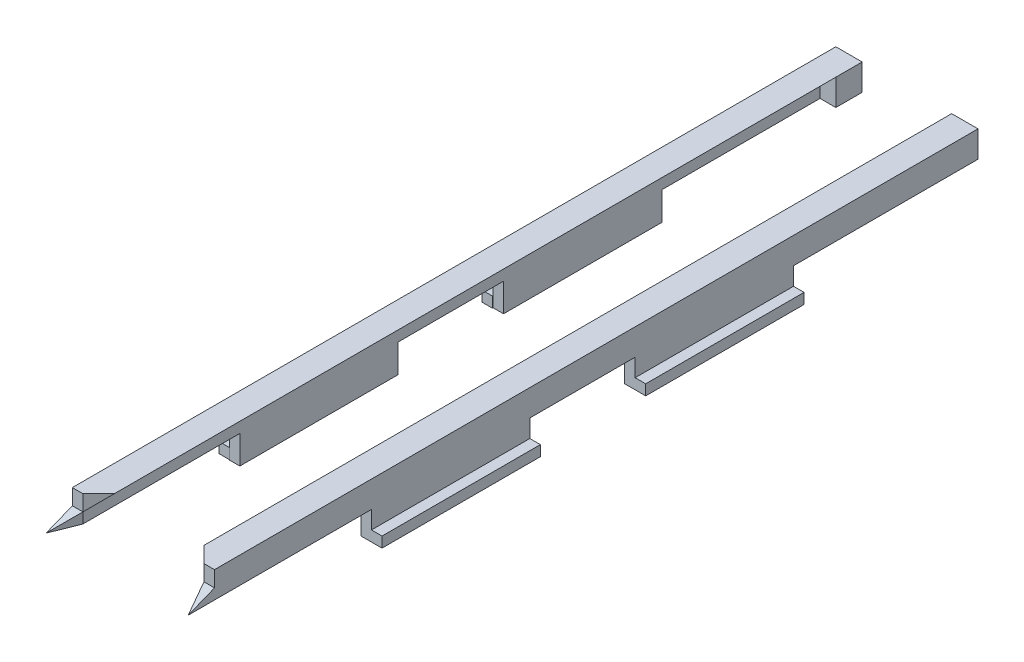
from build123d import *

# Parameters (mm, degrees)
BOSS_EXTRUDE1_DEPTH   = 145
BOSS_EXTRUDE1_2_DEPTH = 145
CUT_EXTRUDE1_DEPTH    = 3
BOSS_EXTRUDE2_DEPTH   = 2
CUT_EXTRUDE2_DEPTH    = 2
BOSS_EXTRUDE3_DEPTH   = 5
CUT_EXTRUDE3_DEPTH    = 3
BOSS_EXTRUDE4_DEPTH   = 2
CUT_EXTRUDE4_DEPTH    = 2
BOSS_EXTRUDE5_DEPTH   = 5
SKETCH12_W            = 30.080177601
SKETCH12_H            = 5.371702136
SKETCH12_W_2          = 30.0801776
BOSS_EXTRUDE6_DEPTH   = 2
SKETCH13_W            = 30.015649286
SKETCH13_H            = 2
BOSS_EXTRUDE7_DEPTH   = 2
SKETCH15_W            = 30.0801776
SKETCH15_H            = 3.371702136
SKETCH15_H_2          = 2
SKETCH15_W_2          = 30.080177601
BOSS_EXTRUDE10_DEPTH  = 2
SKETCH16_W            = 30.0801776
SKETCH16_H            = 1.992652885
SKETCH16_W_2          = 30.080177601
BOSS_EXTRUDE11_DEPTH  = 2
SKETCH17_W            = 30.214135347
SKETCH17_H            = 2
BOSS_EXTRUDE12_DEPTH  = 2


with BuildPart() as part:
    # Sketch2 → Boss-Extrude1 (new body)
    with BuildSketch(Plane.XY):
        Polygon((-11.5, 2), (-8.5, 5), (-13.5, 5), (-13.5, 0), (-11.5, 0), align=None)
    extrude(amount=BOSS_EXTRUDE1_DEPTH)

    # Sketch4 → Cut-Extrude1 (cut)
    with BuildSketch(Plane(origin=(0, 5, 0), x_dir=(1, 0, 0), z_dir=(0, 1, 0))):
        Polygon((-8.5, -145), (-8.5, -142), (-11.5, -145), align=None)
    extrude(amount=-CUT_EXTRUDE1_DEPTH, mode=Mode.SUBTRACT)

    # Sketch5 → Boss-Extrude2 (add)
    with BuildSketch(Plane(origin=(-11.5, 0, 0), x_dir=(0, 0, -1), z_dir=(1, 0, 0))):
        Polygon((-145, 0), (-150, 0), (-145, 2), align=None)
    extrude(amount=-BOSS_EXTRUDE2_DEPTH)

    # Sketch6 → Cut-Extrude2 (cut)
    with BuildSketch(Plane.XZ):
        Polygon((-13.5, 150), (-11.5, 150), (-11.5, 145), align=None)
    extrude(amount=-CUT_EXTRUDE2_DEPTH, mode=Mode.SUBTRACT)

    # Sketch7 → Boss-Extrude3 (add)
    with BuildSketch(Plane(origin=(0, 0, 0), x_dir=(-1, 0, 0), z_dir=(0, 0, -1))):
        Polygon((8.5, 5), (11.5, 2), (11.5, 0), (8.5, 0), align=None)
    extrude(amount=-BOSS_EXTRUDE3_DEPTH)

    # Sketch12 → Boss-Extrude6 (add)
    with BuildSketch(Plane(origin=(-13.5, 0, 0), x_dir=(0, 0, -1), z_dir=(1, 0, 0))):
        with Locations((-50.069244291, -2.685851068)):
            Rectangle(SKETCH12_W, SKETCH12_H)
        with Locations((-100.149421892, -2.685851068)):
            Rectangle(SKETCH12_W_2, SKETCH12_H)
    extrude(amount=BOSS_EXTRUDE6_DEPTH)

    # Sketch13 → Boss-Extrude7 (add)
    with BuildSketch(Plane(origin=(-13.5, 0, 0), x_dir=(0, 0, -1), z_dir=(1, 0, 0))):
        with Locations((-100.117157735, -4.371702136)):
            Rectangle(SKETCH13_W, SKETCH13_H)
    extrude(amount=-BOSS_EXTRUDE7_DEPTH)

    # Sketch17 → Boss-Extrude12 (add)
    with BuildSketch(Plane.ZY.offset(13.5)):
        with Locations((50.136223165, -4.371702136)):
            Rectangle(SKETCH17_W, SKETCH17_H)
    extrude(amount=BOSS_EXTRUDE12_DEPTH)


with BuildPart() as body_2:
    # Sketch2 → Boss-Extrude1 2 (new body)
    with BuildSketch(Plane.XY):
        Polygon((11.5, 0), (11.5, 2), (8.5, 5), (13.5, 5), (13.5, 0), align=None)
    extrude(amount=BOSS_EXTRUDE1_2_DEPTH)

    # Sketch8 → Cut-Extrude3 (cut)
    with BuildSketch(Plane(origin=(0, 5, 0), x_dir=(1, 0, 0), z_dir=(0, 1, 0))):
        Polygon((8.5, -145), (8.5, -142), (11.5, -145), align=None)
    extrude(amount=-CUT_EXTRUDE3_DEPTH, mode=Mode.SUBTRACT)

    # Sketch9 → Boss-Extrude4 (add)
    with BuildSketch(Plane.XZ):
        Polygon((13.5, 145), (13.5, 150), (11.5, 145), align=None)
    extrude(amount=-BOSS_EXTRUDE4_DEPTH)

    # Sketch10 → Cut-Extrude4 (cut)
    with BuildSketch(Plane(origin=(13.5, 0, 0), x_dir=(0, 0, -1), z_dir=(1, 0, 0))):
        Polygon((-150, 2), (-145, 2), (-150, 0), align=None)
    extrude(amount=-CUT_EXTRUDE4_DEPTH, mode=Mode.SUBTRACT)

    # Sketch11 → Boss-Extrude5 (add)
    with BuildSketch(Plane(origin=(0, 0, 0), x_dir=(-1, 0, 0), z_dir=(0, 0, -1))):
        Polygon((-8.5, 5), (-8.5, 0), (-11.5, 0), (-11.5, 2), align=None)
    extrude(amount=-BOSS_EXTRUDE5_DEPTH)

    # Sketch15 → Boss-Extrude10 (add)
    with BuildSketch(Plane.ZY.offset(-13.5)):
        with Locations((100.149421892, -1.685851068)):
            Rectangle(SKETCH15_W, SKETCH15_H)
        with Locations((100.149421892, -4.371702136)):
            Rectangle(SKETCH15_W, SKETCH15_H_2)
        with Locations((50.069244291, -1.685851068)):
            Rectangle(SKETCH15_W_2, SKETCH15_H)
        with Locations((50.069244291, -4.371702136)):
            Rectangle(SKETCH15_W_2, SKETCH15_H_2)
    extrude(amount=BOSS_EXTRUDE10_DEPTH)

    # Sketch16 → Boss-Extrude11 (add)
    with BuildSketch(Plane(origin=(13.5, 0, 0), x_dir=(0, 0, -1), z_dir=(1, 0, 0))):
        with Locations((-100.149421892, -4.375375694)):
            Rectangle(SKETCH16_W, SKETCH16_H)
        with Locations((-50.069244291, -4.375375694)):
            Rectangle(SKETCH16_W_2, SKETCH16_H)
    extrude(amount=BOSS_EXTRUDE11_DEPTH)


solid = Compound([part.part, body_2.part])
